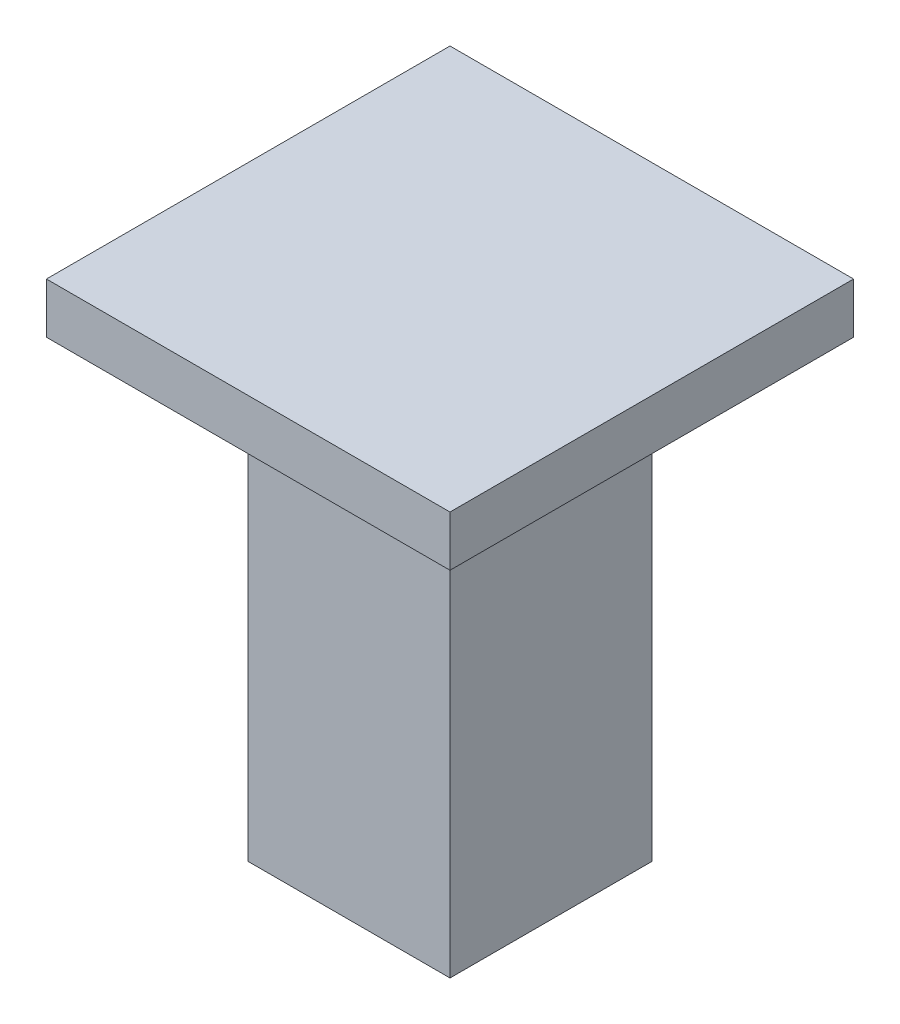
from build123d import *

# Parameters (mm, degrees)
SKETCH1_W           = 20
SKETCH1_H           = 20
BOSS_EXTRUDE1_DEPTH = 50
SKETCH2_W           = 40
SKETCH2_H           = 40
BOSS_EXTRUDE2_DEPTH = 5


with BuildPart() as part:
    # Sketch1 → Boss-Extrude1 (new body)
    with BuildSketch(Plane(origin=(0, 0, 0), x_dir=(1, 0, 0), z_dir=(0, 1, 0))):
        with Locations((10, -10)):
            Rectangle(SKETCH1_W, SKETCH1_H)
    extrude(amount=BOSS_EXTRUDE1_DEPTH)

    # Sketch2 → Boss-Extrude2 (add)
    with BuildSketch(Plane(origin=(0, 50, 0), x_dir=(1, 0, 0), z_dir=(0, 1, 0))):
        with Locations((10, -10)):
            Rectangle(SKETCH2_W, SKETCH2_H)
    extrude(amount=-BOSS_EXTRUDE2_DEPTH)


solid = part.part
